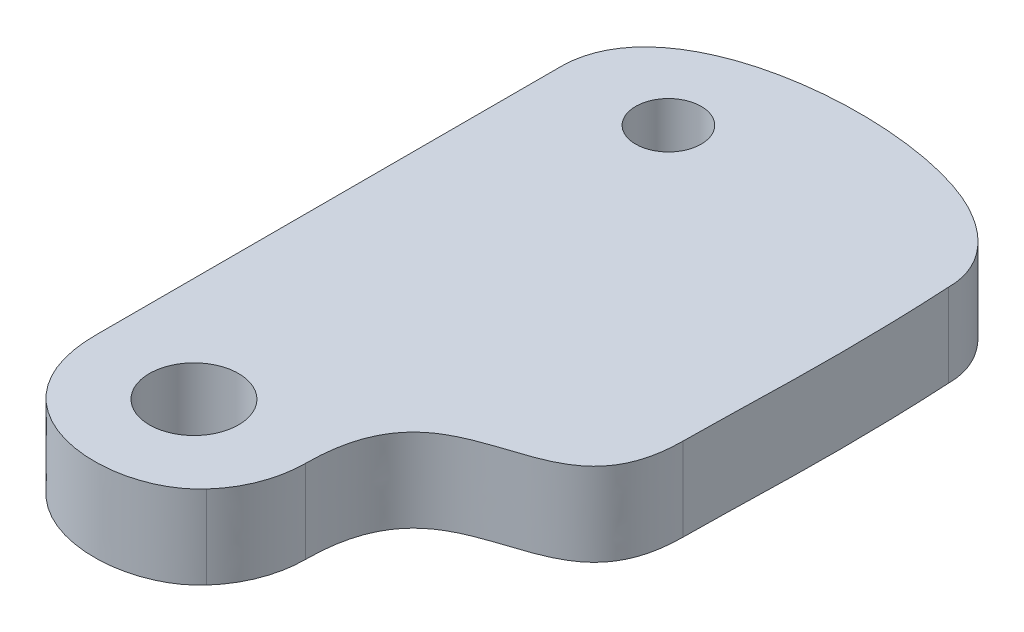
from build123d import *

# Parameters (mm, degrees)
SKETCH1_R           = 1.7
SKETCH1_R_2         = 1.25
BOSS_EXTRUDE1_DEPTH = 3.175


with BuildPart() as part:
    # Sketch1 → Boss-Extrude1 (new body)
    with BuildSketch(Plane(origin=(0, 0, 0), x_dir=(1, 0, 0), z_dir=(0, 1, 0))):
        with BuildLine():
            Line((-7.40608976, 8.047333881), (-7.40608976, -9.667484989))
            add(Edge.make_bspline(
                [(-7.40608976, -9.667484989), (-7.427440527, -14.359265116), (-2.104976514, -14.822390535), (-0.211157807, -12.684787438)],
                knots=[3, 3, 3, 3, 4, 4, 4, 4], degree=3))
            add(Edge.make_bspline(
                [(-0.211157807, -12.684787438), (0.454759152, -11.961542687), (0.830932646, -10.979054864), (0.834200784, -9.953266472)],
                knots=[4, 4, 4, 4, 5, 5, 5, 5], degree=3))
            add(Edge.make_bspline(
                [(0.834200784, -9.953266472), (0.847614911, -3.759244356), (7.276744818, -7.46221529), (7.299751606, -2.008967061)],
                knots=[5, 5, 5, 5, 6, 6, 6, 6], degree=3))
            add(Edge.make_bspline(
                [(7.299751606, -2.008967061), (7.310026672, 0.456281555), (7.523736335, 3.752134489), (7.276744819, 8.147321264)],
                knots=[6, 6, 6, 6, 7, 7, 7, 7], degree=3))
            add(Edge.make_bspline(
                [(7.276744819, 8.147321264), (7.287246129, 9.173061108), (6.632340018, 10.163694097), (5.456847891, 10.900933881)],
                knots=[7, 7, 7, 7, 8, 8, 8, 8], degree=3))
            add(Edge.make_bspline(
                [(5.456847891, 10.900933881), (2.10699507, 13.081407092), (-7.386860521, 12.739250307), (-7.40608976, 8.047333881)],
                knots=[8, 8, 8, 8, 9, 9, 9, 9], degree=3))
        make_face()
        with Locations(Location((-3.413173976, -9.953168809, 0), (0, 0, 270))):
            Circle(SKETCH1_R, mode=Mode.SUBTRACT)
        with Locations(Location((-3.413271461, 8.147321264, 0), (0, 0, 270))):
            Circle(SKETCH1_R_2, mode=Mode.SUBTRACT)
    extrude(amount=BOSS_EXTRUDE1_DEPTH)


solid = part.part
